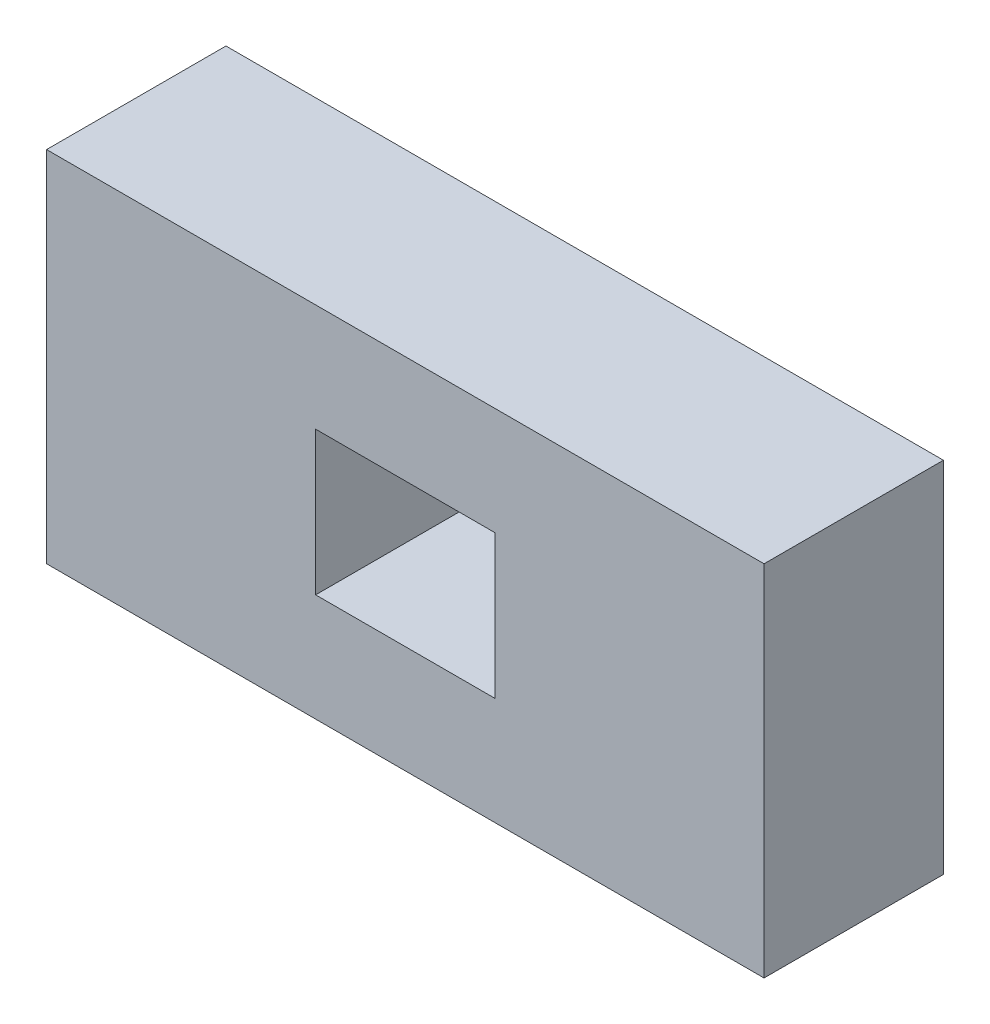
from build123d import *

# Parameters (mm, degrees)
RECTANGLESKETCH_W   = 40
RECTANGLESKETCH_H   = 20
BLINDBOSS_DEPTH     = 10
CUTSKETCH_W         = 10
CUTSKETCH_H         = 8
THROUGHALLCUT_DEPTH = 46.82575695


with BuildPart() as part:
    # RectangleSketch → BlindBoss (new body)
    with BuildSketch(Plane.XY):
        with Locations((20, 10)):
            Rectangle(RECTANGLESKETCH_W, RECTANGLESKETCH_H)
    extrude(amount=BLINDBOSS_DEPTH)

    # CutSketch → ThroughAllCut (cut, through all)
    with BuildSketch(Plane.XY.offset(10)):
        with Locations((20, 10)):
            Rectangle(CUTSKETCH_W, CUTSKETCH_H)
    extrude(amount=-THROUGHALLCUT_DEPTH, mode=Mode.SUBTRACT)


solid = part.part
